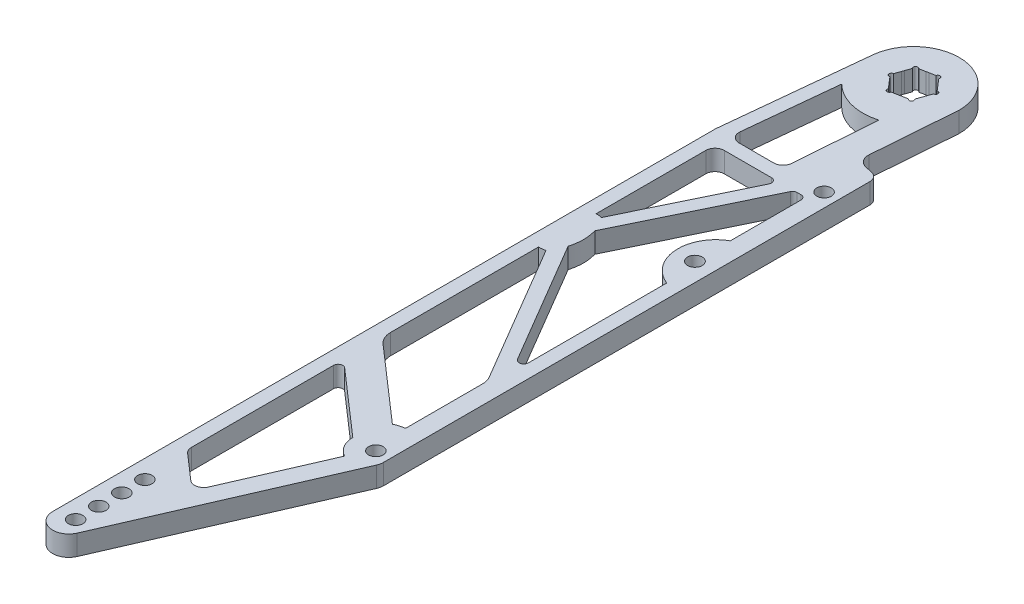
from build123d import *

# Parameters (mm, degrees)
SKETCH2_R           = 2
SKETCH2_R_2         = 1.999999991
BOSS_EXTRUDE1_DEPTH = 5.588
SKETCH7_R           = 2.032
CUT_EXTRUDE1_DEPTH  = 5.588
CUT_EXTRUDE2_DEPTH  = 226.492641696


with BuildPart() as part:
    # Sketch2 → Boss-Extrude1 (new body)
    with BuildSketch(Plane(origin=(0, 0, 0), x_dir=(1, 0, 0), z_dir=(0, 1, 0))):
        with BuildLine():
            ThreePointArc((17.295902343, -29.323452593), (16.73639375, -27.733089808), (15.304363929, -26.843373987))
            Line((15.304363929, -26.843373987), (13.284423018, -26.396670406))
            ThreePointArc((13.284423018, -26.396670406), (11.420627025, -25.189010374), (10.804170553, -23.055431298))
            Line((10.804170553, -23.055431298), (12.5603, 0))
            ThreePointArc((12.5603, 0), (0.640974044, 12.543934326), (-12.49487995, 1.28027775))
            Line((-12.49487995, 1.28027775), (-16.496770465, -37.776201638))
            ThreePointArc((-16.496770465, -37.776201638), (-16.50669046, -37.90548449), (-16.51, -38.035105126))
            Line((-16.51, -38.035105126), (-16.51, -220.313887427))
            ThreePointArc((-16.51, -220.313887427), (-12.970187584, -224.665744552), (-7.988667969, -222.086327038))
            Line((-7.988667969, -222.086327038), (16.979901226, -164.662549258))
            ThreePointArc((16.979901226, -164.662549258), (17.216065593, -163.919190378), (17.295902343, -163.143315306))
            Line((17.295902343, -163.143315306), (17.295902343, -29.323452593))
        make_face()
        with Locations(Location((-11.43, -219.075, 0), (0, 0, 270))):
            Circle(SKETCH2_R, mode=Mode.SUBTRACT)
        with Locations(Location((-11.43, -212.725, 0), (0, 0, 270))):
            Circle(SKETCH2_R, mode=Mode.SUBTRACT)
        with Locations(Location((-11.43, -206.375, 0), (0, 0, 270))):
            Circle(SKETCH2_R, mode=Mode.SUBTRACT)
        with Locations(Location((-11.43, -200.025, 0), (0, 0, 270))):
            Circle(SKETCH2_R, mode=Mode.SUBTRACT)
        with BuildLine():
            ThreePointArc((7.135902343, -161.395796446), (8.023611961, -164.633987883), (10.438542905, -166.966801782))
            Line((10.438542905, -166.966801782), (-0.894016375, -193.029903785))
            ThreePointArc((-0.894016375, -193.029903785), (-2.665854515, -194.495144898), (-4.89449504, -193.929898651))
            Line((-4.89449504, -193.929898651), (-11.831146076, -187.869646091))
            ThreePointArc((-11.831146076, -187.869646091), (-12.472607947, -187.007278248), (-12.7, -185.95682859))
            Line((-12.7, -185.95682859), (-12.7, -146.861981888))
            ThreePointArc((-12.7, -146.861981888), (-11.955224829, -145.705677915), (-10.594426962, -145.905573138))
            Line((-10.594426962, -145.905573138), (7.135902343, -161.395796446))
        make_face(mode=Mode.SUBTRACT)
        with BuildLine():
            ThreePointArc((12.215902343, -151.955842791), (10.785297541, -152.261664921), (9.418398214, -152.782955151))
            Line((9.418398214, -152.782955151), (-10.962292152, -134.977225798))
            ThreePointArc((-10.962292152, -134.977225798), (-12.245215894, -133.252490112), (-12.7, -131.151590796))
            Line((-12.7, -131.151590796), (-12.7, -90.4875))
            ThreePointArc((-12.7, -90.4875), (-11.765673597, -90.432318214), (-10.844338135, -90.267540106))
            Line((-10.844338135, -90.267540106), (11.513275375, -128.23323342))
            ThreePointArc((11.513275375, -128.23323342), (12.037098881, -129.475107855), (12.215902343, -130.811024207))
            Line((12.215902343, -130.811024207), (12.215902343, -151.955842791))
        make_face(mode=Mode.SUBTRACT)
        with Locations(Location((13.485902343, -161.395796446, 0), (0, 0, 270))):
            Circle(SKETCH2_R, mode=Mode.SUBTRACT)
        with BuildLine():
            Line((-10.16, -41.91), (2.838491406, -41.91))
            ThreePointArc((2.838491406, -41.91), (3.914572403, -42.505500417), (3.981509018, -43.733543799))
            Line((3.981509018, -43.733543799), (-11.055993219, -74.784618621))
            ThreePointArc((-11.055993219, -74.784618621), (-11.873503915, -74.655646925), (-12.7, -74.6125))
            Line((-12.7, -74.6125), (-12.7, -44.45))
            ThreePointArc((-12.7, -44.45), (-11.956051224, -42.653948776), (-10.16, -41.91))
        make_face(mode=Mode.SUBTRACT)
        with BuildLine():
            ThreePointArc((-9.886442157, -38.1), (-11.771808813, -37.262055396), (-12.413212622, -35.301096512))
            Line((-12.413212622, -35.301096512), (-9.81475239, -9.941405108))
            ThreePointArc((-9.81475239, -9.941405108), (-3.431386466, -13.542026692), (3.896359547, -13.415635739))
            Line((3.896359547, -13.415635739), (2.194931831, -35.752912681))
            ThreePointArc((2.194931831, -35.752912681), (1.388767881, -37.42300808), (-0.337731726, -38.1))
            Line((-0.337731726, -38.1), (-9.886442157, -38.1))
        make_face(mode=Mode.SUBTRACT)
        with BuildLine():
            ThreePointArc((3.111707299, -3.622128204), (-4.505881672, 1.581001391), (4.69270869, 0.883753468))
            Line((4.69270869, 0.883753468), (3.111707299, -3.622128204))
        make_face(mode=Mode.SUBTRACT)
        with BuildLine():
            ThreePointArc((-8.804706991, -86.222769023), (-8.262040897, -82.55), (-8.804706991, -78.877230977))
            Line((-8.804706991, -78.877230977), (8.75092063, -42.626456201))
            ThreePointArc((8.75092063, -42.626456201), (9.219438659, -42.103919003), (9.893938242, -41.91))
            Line((9.893938242, -41.91), (10.945902343, -41.91))
            ThreePointArc((10.945902343, -41.91), (11.843927955, -42.281974388), (12.215902343, -43.18))
            Line((12.215902343, -43.18), (12.215902343, -62.618124667))
            ThreePointArc((12.215902343, -62.618124667), (6.906756389, -72.428110561), (13.516748759, -81.413145613))
            Line((13.516748759, -81.413145613), (13.516748759, -119.431411199))
            ThreePointArc((13.516748759, -119.431411199), (12.599191369, -120.688899116), (11.152950849, -120.113072943))
            Line((11.152950849, -120.113072943), (-8.804706991, -86.222769023))
        make_face(mode=Mode.SUBTRACT)
        with Locations(Location((13.485902343, -38.1, 0), (0, 0, 270))):
            Circle(SKETCH2_R_2, mode=Mode.SUBTRACT)
    extrude(amount=BOSS_EXTRUDE1_DEPTH)

    # Sketch7 → Cut-Extrude1 (cut)
    with BuildSketch(Plane(origin=(0, 5.588, 0), x_dir=(1, 0, 0), z_dir=(0, 1, 0))):
        with Locations(Location((12.215902343, -72.362149281, 0), (0, 0, 270))):
            Circle(SKETCH7_R)
    extrude(amount=-CUT_EXTRUDE1_DEPTH, mode=Mode.SUBTRACT)

    # Sketch8 → Cut-Extrude2 (cut, through all)
    with BuildSketch(Plane(origin=(0, 5.588, 0), x_dir=(1, 0, 0), z_dir=(0, 1, 0))):
        with BuildLine():
            Line((1.104680914, 5.054256967), (-2.867487033, 4.306199197))
            ThreePointArc((-2.867487033, 4.306199197), (-3.806203053, 4.430543784), (-3.824774473, 3.483810218))
            Line((-3.824774473, 3.483810218), (-5.163021415, -0.330217017))
            ThreePointArc((-5.163021415, -0.330217017), (-5.740064996, -1.080996644), (-4.929455388, -1.570446748))
            Line((-4.929455388, -1.570446748), (-2.295534382, -4.636416214))
            ThreePointArc((-2.295534382, -4.636416214), (-1.933861943, -5.511540428), (-1.104680914, -5.054256967))
            Line((-1.104680914, -5.054256967), (2.867487033, -4.306199197))
            ThreePointArc((2.867487033, -4.306199197), (3.806203053, -4.430543784), (3.824774473, -3.483810218))
            Line((3.824774473, -3.483810218), (5.163021415, 0.330217017))
            ThreePointArc((5.163021415, 0.330217017), (5.740064996, 1.080996644), (4.929455388, 1.570446748))
            Line((4.929455388, 1.570446748), (2.295534382, 4.636416214))
            ThreePointArc((2.295534382, 4.636416214), (1.933861943, 5.511540428), (1.104680914, 5.054256967))
        make_face()
    extrude(amount=-CUT_EXTRUDE2_DEPTH, mode=Mode.SUBTRACT)


solid = part.part
